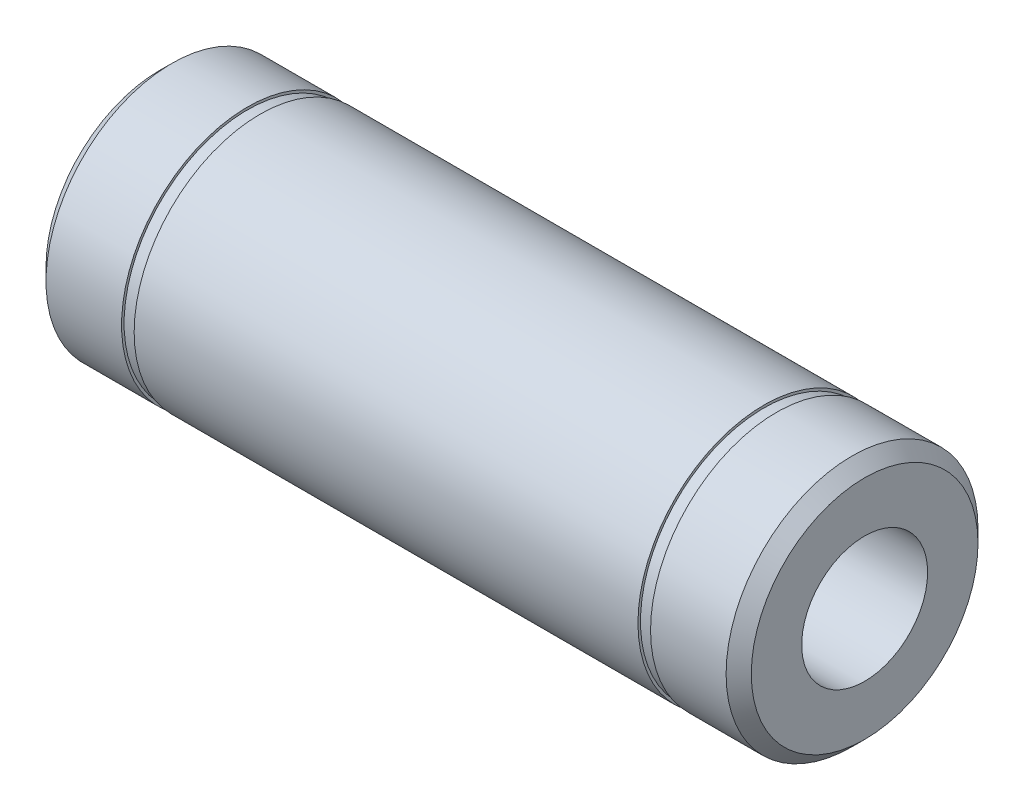
from build123d import *

# Parameters (mm, degrees)
SKETCH_1_R          = 5
SKETCH_1_R_2        = 2.5
EXTRUDE_1_DEPTH     = 14
CHAMFER_1_SIZE      = 0.5
CUT_EXTRUDE_START   = -10
SKETCH_3_OUTSIDE_W  = 18.274
SKETCH_3_OUTSIDE_H  = 18.274
SKETCH_3_OUTSIDE_R  = 4.9
CUT_EXTRUDE_1_DEPTH = 0.5


with BuildPart() as part:
    # 草图1 → 凸台-拉伸1 (new, symmetric)
    with BuildSketch(Plane(origin=(0, 0, 0), x_dir=(0, 0, -1), z_dir=(1, 0, 0))):
        Circle(SKETCH_1_R)
        Circle(SKETCH_1_R_2, mode=Mode.SUBTRACT)
    extrude(amount=EXTRUDE_1_DEPTH, both=True)

    # 倒角1
    chamfer_1_edges = [part.edges().sort_by_distance(p)[0] for p in [
        (-14, 0, 5),
        (14, 0, 5),
    ]]
    chamfer(chamfer_1_edges, length=CHAMFER_1_SIZE)

    # 草图3 outside → 切除-拉伸1 (cut)
    with BuildSketch(Plane(origin=(0, 0, 0), x_dir=(0, 0, -1), z_dir=(1, 0, 0)).offset(CUT_EXTRUDE_START)):
        Rectangle(SKETCH_3_OUTSIDE_W, SKETCH_3_OUTSIDE_H)
        Circle(SKETCH_3_OUTSIDE_R, mode=Mode.SUBTRACT)
    cut_extrude_1 = extrude(amount=-CUT_EXTRUDE_1_DEPTH, mode=Mode.SUBTRACT)

    # 镜向1: 切除-拉伸1 across plane
    add(cut_extrude_1.mirror(Plane(origin=(0, 0, 0), x_dir=(0, 0, 1), z_dir=(1, 0, 0))), mode=Mode.SUBTRACT)


solid = part.part
